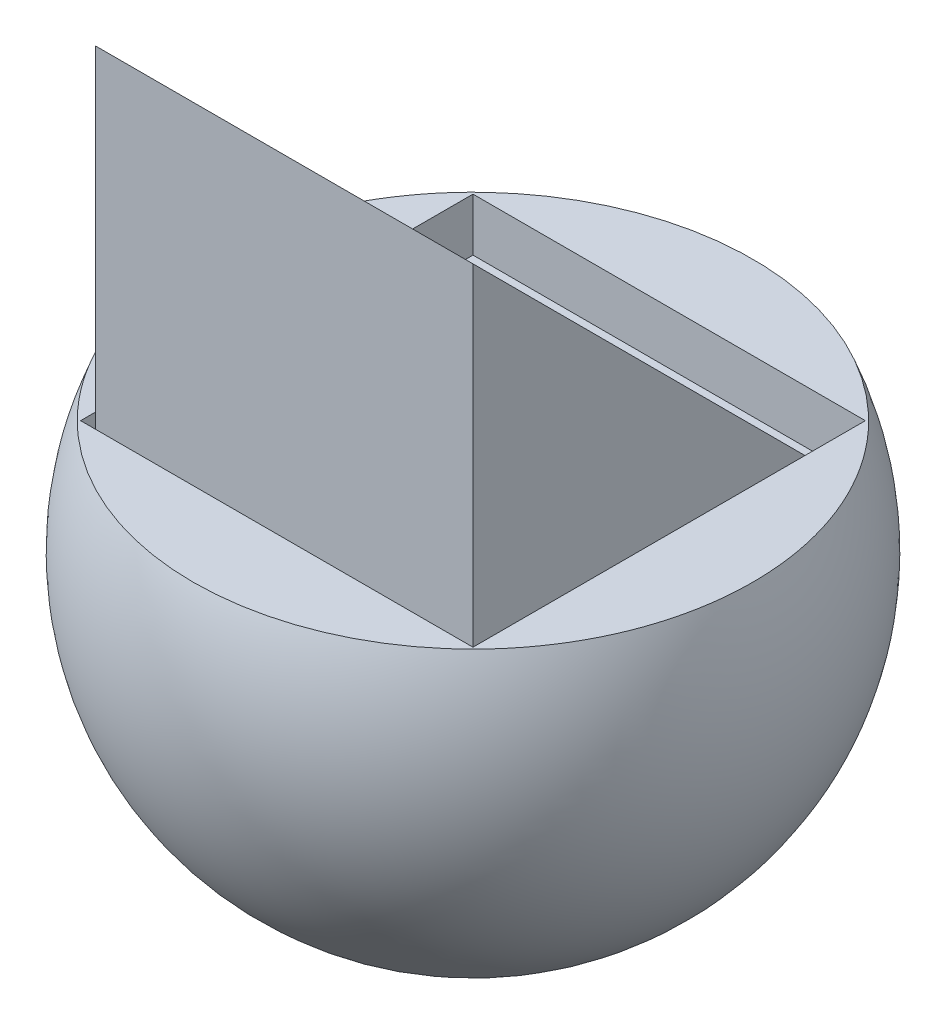
from build123d import *

# Parameters (mm, degrees)
SKETCH_2_W               = 8
SKETCH_2_H               = 8
CUT_EXTRUDE_1_DEPTH      = 10
SKETCH_6_R               = 1.5
CUT_EXTRUDE_2_DEPTH      = 9.246211251
SKETCH_8_W               = 5
SKETCH_8_H               = 5
CUT_EXTRUDE_3_DEPTH      = 1.2
EXTRUDE_4_DEPTH          = 2.5
SKETCH_11_R              = 3.996071485
SKETCH_11_W              = 5
SKETCH_11_H              = 5
CUT_EXTRUDE_5_DEPTH      = 0.5
CUT_EXTRUDE_6_REACH      = 10.102
CUT_EXTRUDE_6_END_RADIUS = 4
SKETCH_12_W              = 1
SKETCH_12_H              = 1
SKETCH_13_W              = 5.2
SKETCH_13_H              = 5.2
SKETCH_13_W_2            = 5
SKETCH_13_H_2            = 5
CUT_EXTRUDE_1_2_DEPTH    = 0.7


with BuildPart() as part:
    # 草图1 → 旋转1 (revolve)
    with BuildSketch(Plane(origin=(0, 0, 0), x_dir=(1, 0, 0), z_dir=(0, 1, 0))):
        with BuildLine():
            Line((-4, 0), (4, 0))
            ThreePointArc((4, 0), (0, -4), (-4, 0))
        make_face()
    revolve(axis=Axis((-4, 0, 0), (1, 0, 0)))

    # 草图2 → Cut-Extrude 1 (cut)
    with BuildSketch(Plane(origin=(0, 2, 0), x_dir=(1, 0, 0), z_dir=(0, 1, 0))):
        Rectangle(SKETCH_2_W, SKETCH_2_H)
    extrude(amount=CUT_EXTRUDE_1_DEPTH, mode=Mode.SUBTRACT)

    # 草图6 → 切除-拉伸2 (cut, through all)
    with BuildSketch(Plane(origin=(0, 2, 0), x_dir=(1, 0, 0), z_dir=(0, 1, 0))):
        with Locations(Location((0, 0, 0), (0, 0, 270))):
            Circle(SKETCH_6_R)
    extrude(amount=-CUT_EXTRUDE_2_DEPTH, mode=Mode.SUBTRACT)

    # 草图8 → 切除-拉伸3 (cut)
    with BuildSketch(Plane(origin=(0, 2, 0), x_dir=(1, 0, 0), z_dir=(0, 1, 0))):
        Rectangle(SKETCH_8_W, SKETCH_8_H)
    extrude(amount=-CUT_EXTRUDE_3_DEPTH, mode=Mode.SUBTRACT)

    # 草图11 → 切除-拉伸5 (cut)
    with BuildSketch(Plane(origin=(0, 2, 0), x_dir=(1, 0, 0), z_dir=(0, 1, 0))):
        Circle(SKETCH_11_R)
        Rectangle(SKETCH_11_W, SKETCH_11_H, mode=Mode.SUBTRACT)
    extrude(amount=-CUT_EXTRUDE_5_DEPTH, mode=Mode.SUBTRACT)

    # 切除-拉伸6: up to this sphere (the profile starts inside it)
    cut_extrude_6_end = Location((0, 0, 0)) * Sphere(CUT_EXTRUDE_6_END_RADIUS, mode=Mode.PRIVATE)
    # 草图12 → 切除-拉伸6 (cut, up to the surface)
    with BuildSketch(Plane(origin=(0, 0, 0), x_dir=(0, 0, -1), z_dir=(1, 0, 0)), mode=Mode.PRIVATE) as cut_extrude_6_sk1:
        Rectangle(SKETCH_12_W, SKETCH_12_H)
    cut_extrude_6_tool1 = extrude(cut_extrude_6_sk1.sketch, amount=-CUT_EXTRUDE_6_REACH, mode=Mode.PRIVATE) & cut_extrude_6_end
    add(cut_extrude_6_tool1.solids().sort_by_distance((0, 0, 0))[0], mode=Mode.SUBTRACT)

    # 草图13 → Cut-Extrude 1 2 (cut)
    with BuildSketch(Plane(origin=(0, 1.5, 0), x_dir=(1, 0, 0), z_dir=(0, 1, 0))):
        Rectangle(SKETCH_13_W, SKETCH_13_H)
        Rectangle(SKETCH_13_W_2, SKETCH_13_H_2, mode=Mode.SUBTRACT)
    extrude(amount=-CUT_EXTRUDE_1_2_DEPTH, mode=Mode.SUBTRACT)


with BuildPart() as body_2:
    # 草图7 → 凸台-拉伸4 (new, symmetric)
    with BuildSketch(Plane(origin=(0, 0, 0), x_dir=(0, 0, -1), z_dir=(1, 0, 0))):
        Polygon((-2.5, 5.8), (-2.5, 0.8), (2.5, 0.8), align=None)
    extrude(amount=EXTRUDE_4_DEPTH, both=True)


solid = Compound([part.part, body_2.part])
